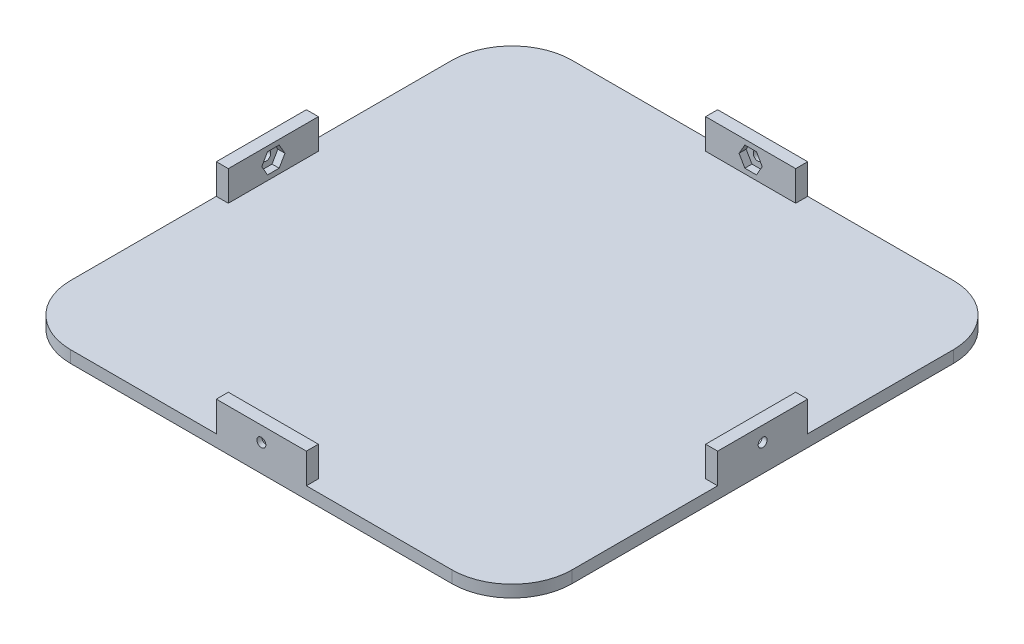
from build123d import *

# Parameters (mm, degrees)
ESQUISSE1_W                  = 212.09
ESQUISSE1_H                  = 212.09
BOSS_EXTRU_1_DEPTH           = 5.08
ESQUISSE2_W                  = 38.1
ESQUISSE2_H                  = 5.08
ESQUISSE2_W_2                = 5.08
ESQUISSE2_H_2                = 38.1
BOSS_EXTRU_2_DEPTH           = 12.7
CONG_1_R                     = 25.4
D_GAGEMENT_61_D              = 3.7973
ENL_V_MAT_EXTRU_1_DEPTH      = 3
R_P_TITION_CIRCULAIRE1_COUNT = 4


with BuildPart() as part:
    # Esquisse1 → Boss.-Extru.1 (new body)
    with BuildSketch(Plane(origin=(0, 0, 0), x_dir=(1, 0, 0), z_dir=(0, 1, 0))):
        Rectangle(ESQUISSE1_W, ESQUISSE1_H)
    extrude(amount=BOSS_EXTRU_1_DEPTH)

    # Esquisse2 → Boss.-Extru.2 (add)
    with BuildSketch(Plane(origin=(0, 5.08, 0), x_dir=(1, 0, 0), z_dir=(0, 1, 0))):
        with Locations((0, -103.505)):
            Rectangle(ESQUISSE2_W, ESQUISSE2_H)
        with Locations((-103.505, 0)):
            Rectangle(ESQUISSE2_W_2, ESQUISSE2_H_2)
        with Locations((0, 103.505)):
            Rectangle(ESQUISSE2_W, ESQUISSE2_H)
        with Locations((103.505, 0)):
            Rectangle(ESQUISSE2_W_2, ESQUISSE2_H_2)
    extrude(amount=BOSS_EXTRU_2_DEPTH)

    # Congé1
    cong_1_edges = [part.edges().sort_by_distance(p)[0] for p in [
        (-106.045, 2.54, -106.045),
        (106.045, 2.54, -106.045),
        (106.045, 2.54, 106.045),
        (-106.045, 2.54, 106.045),
    ]]
    fillet(cong_1_edges, radius=CONG_1_R)

    # Dégagement #61 (through all)
    with Locations(Plane.XY.offset(106.045)):
        with Locations((0, 11.43)):
            d_gagement_61 = Hole(D_GAGEMENT_61_D / 2)

    # Esquisse5 → Enlèv. mat.-Extru.1 (cut)
    with BuildSketch(Plane.XY.offset(-100.965)):
        Polygon((2.453738644, 15.68), (-2.453738644, 15.68), (-4.907477288, 11.43), (-2.453738644, 7.18), (2.453738644, 7.18), (4.907477288, 11.43), align=None)
    enl_v_mat_extru_1 = extrude(amount=-ENL_V_MAT_EXTRU_1_DEPTH, mode=Mode.SUBTRACT)

    # Répétition circulaire1: Dégagement #61, Enlèv. mat.-Extru.1 ×4 about axis
    r_p_tition_circulaire1_axis = Axis((0, 0, 0), (0, 1, 0))
    add([d_gagement_61.rotate(r_p_tition_circulaire1_axis, i * 360 / R_P_TITION_CIRCULAIRE1_COUNT) for i in range(1, R_P_TITION_CIRCULAIRE1_COUNT)], mode=Mode.SUBTRACT)
    add([enl_v_mat_extru_1.rotate(r_p_tition_circulaire1_axis, i * 360 / R_P_TITION_CIRCULAIRE1_COUNT) for i in range(1, R_P_TITION_CIRCULAIRE1_COUNT)], mode=Mode.SUBTRACT)


solid = part.part
